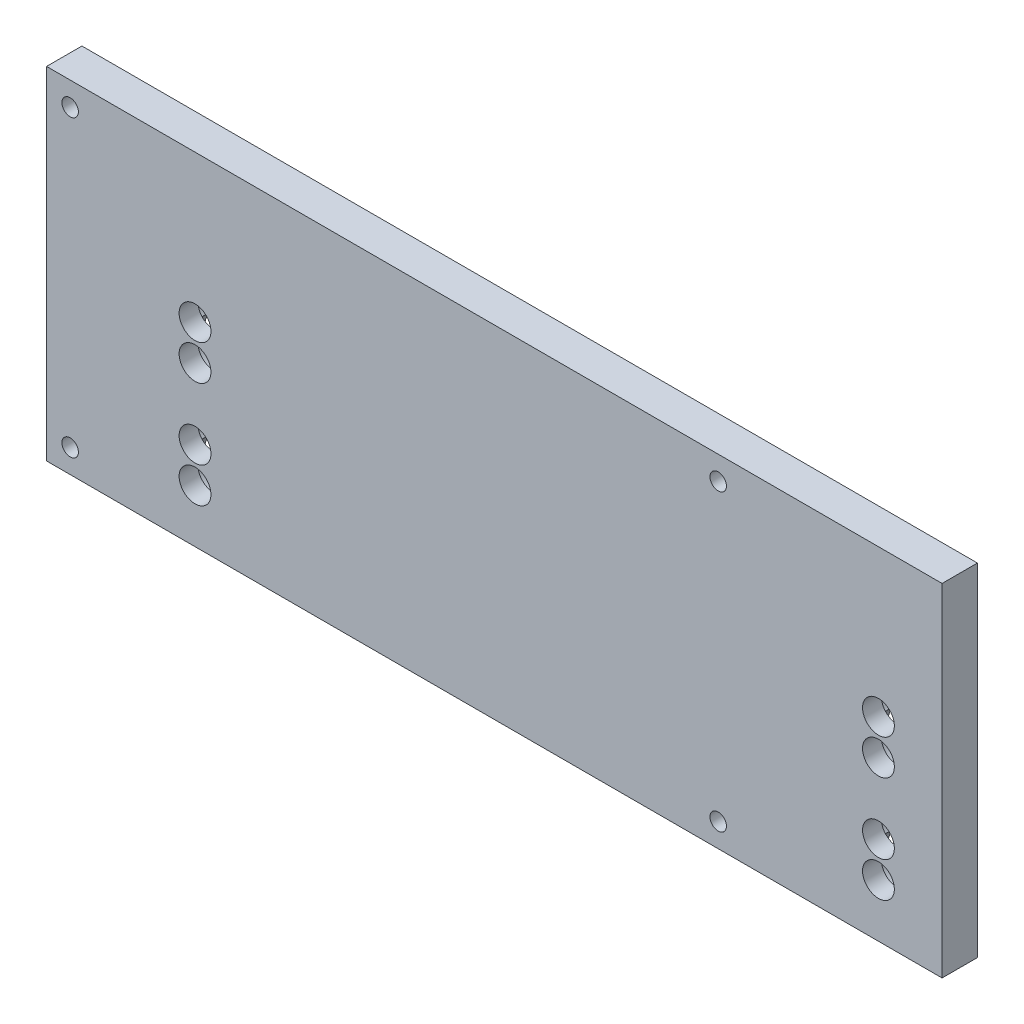
from build123d import *

# Parameters (mm, degrees)
SKIZZE1_W                                            = 380
SKIZZE1_H                                            = 145
AUFSATZ_LINEAR_AUSTRAGEN1_DEPTH                      = 15
F_7_0_7_DURCHMESSER_BOHRUNG1_D                       = 7
STIRNSENKUNG_F_R_M12_SECHSKANTSCHRAUBE_M_D           = 13.5
STIRNSENKUNG_F_R_M12_SECHSKANTSCHRAUBE_M_CBORE_D     = 22
STIRNSENKUNG_F_R_M12_SECHSKANTSCHRAUBE_M_CBORE_DEPTH = 7
LINEARES_MUSTER1_COUNT                               = 2
LINEARES_MUSTER1_PITCH                               = 15


with BuildPart() as part:
    # Skizze1 → Aufsatz-Linear austragen1 (new body)
    with BuildSketch(Plane(origin=(0, 0, 0), x_dir=(-1, 0, 0), z_dir=(0, 0, -1))):
        with Locations((-190, -72.5)):
            Rectangle(SKIZZE1_W, SKIZZE1_H)
    extrude(amount=-AUFSATZ_LINEAR_AUSTRAGEN1_DEPTH)

    # Ø7.0 (7) Durchmesser Bohrung1 (through all)
    with Locations(Plane(origin=(0, 0, 0), x_dir=(-1, 0, 0), z_dir=(0, 0, -1))):
        with Locations((-10, -135), (-10, -10), (-285, -10), (-285, -135)):
            Hole(F_7_0_7_DURCHMESSER_BOHRUNG1_D / 2)

    # Stirnsenkung für M12 Sechskantschraube mit Schaft1 (through all)
    with Locations(Plane(origin=(0, 0, 0), x_dir=(-1, 0, 0), z_dir=(0, 0, -1))):
        with Locations((-63, -62.5), (-63, -107.5), (-353, -107.5), (-353, -62.5)):
            stirnsenkung_f_r_m12_sechskantschraube_m = CounterBoreHole(STIRNSENKUNG_F_R_M12_SECHSKANTSCHRAUBE_M_D / 2, STIRNSENKUNG_F_R_M12_SECHSKANTSCHRAUBE_M_CBORE_D / 2, STIRNSENKUNG_F_R_M12_SECHSKANTSCHRAUBE_M_CBORE_DEPTH)

    # Lineares Muster1: Stirnsenkung für M12 Sechskantschraube mit Schaft1 ×2
    with Locations(*[(0, -i * LINEARES_MUSTER1_PITCH, 0) for i in range(1, LINEARES_MUSTER1_COUNT)]):
        add(stirnsenkung_f_r_m12_sechskantschraube_m, mode=Mode.SUBTRACT)


solid = part.part
